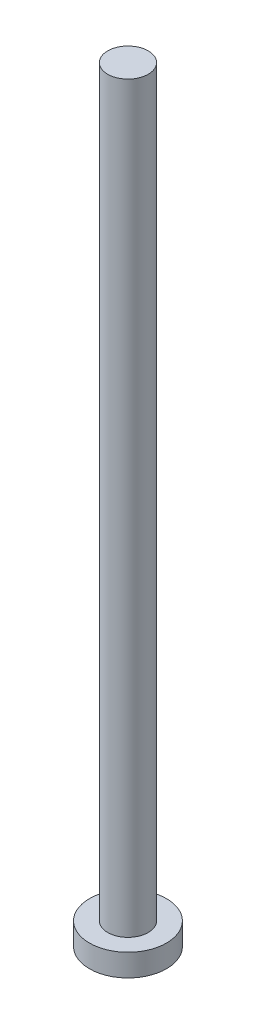
from build123d import *

# Parameters (mm, degrees)
SKETCH_1_R      = 2.85
EXTRUDE_1_DEPTH = 1.65
SKETCH_2_R      = 1.5
EXTRUDE_2_DEPTH = 55


with BuildPart() as part:
    # 草图1 → 凸台-拉伸1 (new body)
    with BuildSketch(Plane(origin=(0, 0, 0), x_dir=(1, 0, 0), z_dir=(0, 1, 0))):
        with Locations(Location((0, 0, 0), (0, 0, 270))):
            Circle(SKETCH_1_R)
    extrude(amount=EXTRUDE_1_DEPTH)

    # 草图2 → 凸台-拉伸2 (add)
    with BuildSketch(Plane(origin=(0, 1.65, 0), x_dir=(1, 0, 0), z_dir=(0, 1, 0))):
        with Locations(Location((0, 0, 0), (0, 0, 270))):
            Circle(SKETCH_2_R)
    extrude(amount=EXTRUDE_2_DEPTH)


solid = part.part
